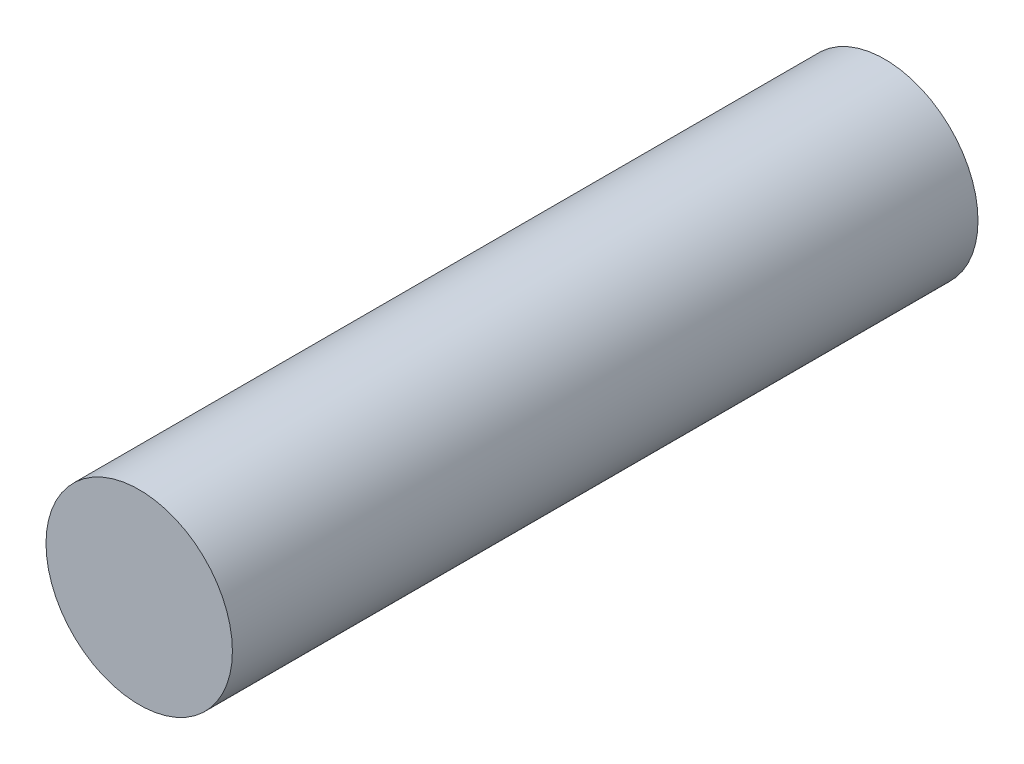
from build123d import *

# Parameters (mm, degrees)
SKETCH_1_R      = 3
EXTRUDE_1_DEPTH = 24


with BuildPart() as part:
    # 스케치1 → 보스-돌출1 (new body)
    with BuildSketch(Plane.XY):
        Circle(SKETCH_1_R)
    extrude(amount=EXTRUDE_1_DEPTH)


solid = part.part
